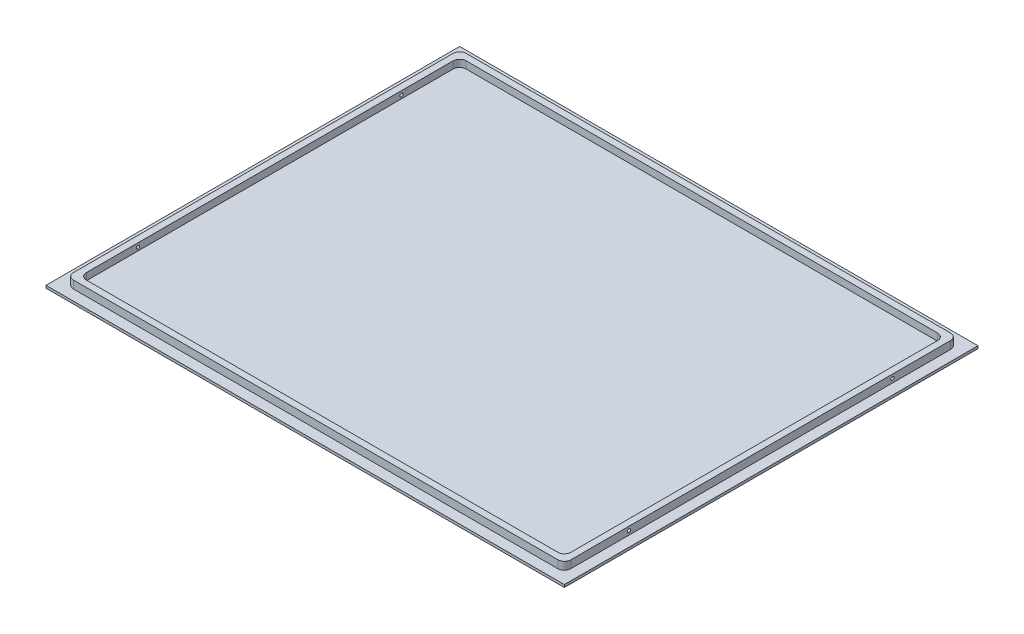
from build123d import *

# Parameters (mm, degrees)
SKETCH1_W          = 401
SKETCH1_H          = 320
EXTRUDE1_DEPTH     = 8
SKETCH2_W          = 401
SKETCH2_H          = 320
SKETCH2_W_2        = 384.8
SKETCH2_H_2        = 303.8
CUT_EXTRUDE1_DEPTH = 6
SKETCH3_W          = 374.8
SKETCH3_H          = 293.8
CUT_EXTRUDE2_DEPTH = 5.5
FILLET1_R          = 5
SKETCH4_R          = 1.25
CUT_EXTRUDE3_DEPTH = 425.304619348


with BuildPart() as part:
    # Sketch1 → Extrude1 (new body)
    with BuildSketch(Plane(origin=(0, 0, 0), x_dir=(1, 0, 0), z_dir=(0, 1, 0))):
        Rectangle(SKETCH1_W, SKETCH1_H)
    extrude(amount=EXTRUDE1_DEPTH)

    # Sketch2 → Cut-Extrude1 (cut)
    with BuildSketch(Plane(origin=(0, 8, 0), x_dir=(1, 0, 0), z_dir=(0, 1, 0))):
        Rectangle(SKETCH2_W, SKETCH2_H)
        Rectangle(SKETCH2_W_2, SKETCH2_H_2, mode=Mode.SUBTRACT)
    extrude(amount=-CUT_EXTRUDE1_DEPTH, mode=Mode.SUBTRACT)

    # Sketch3 → Cut-Extrude2 (cut)
    with BuildSketch(Plane(origin=(0, 8, 0), x_dir=(1, 0, 0), z_dir=(0, 1, 0))):
        Rectangle(SKETCH3_W, SKETCH3_H)
    extrude(amount=-CUT_EXTRUDE2_DEPTH, mode=Mode.SUBTRACT)

    # Fillet1
    fillet1_edges = [part.edges().sort_by_distance(p)[0] for p in [
        (192.4, 5, 151.9),
        (-192.4, 5, 151.9),
        (-192.4, 5, -151.9),
        (192.4, 5, -151.9),
        (-187.4, 5.25, 146.9),
        (-187.4, 5.25, -146.9),
        (187.4, 5.25, -146.9),
        (187.4, 5.25, 146.9),
    ]]
    fillet(fillet1_edges, radius=FILLET1_R)

    # Sketch4 → Cut-Extrude3 (cut, through all)
    with BuildSketch(Plane.ZY.offset(192.4)):
        with Locations(Location((-101.9, 5, 0), (0, 0, 180))):
            Circle(SKETCH4_R)
        with Locations(Location((101.9, 5, 0), (0, 0, 180))):
            Circle(SKETCH4_R)
    extrude(amount=-CUT_EXTRUDE3_DEPTH, mode=Mode.SUBTRACT)


solid = part.part
